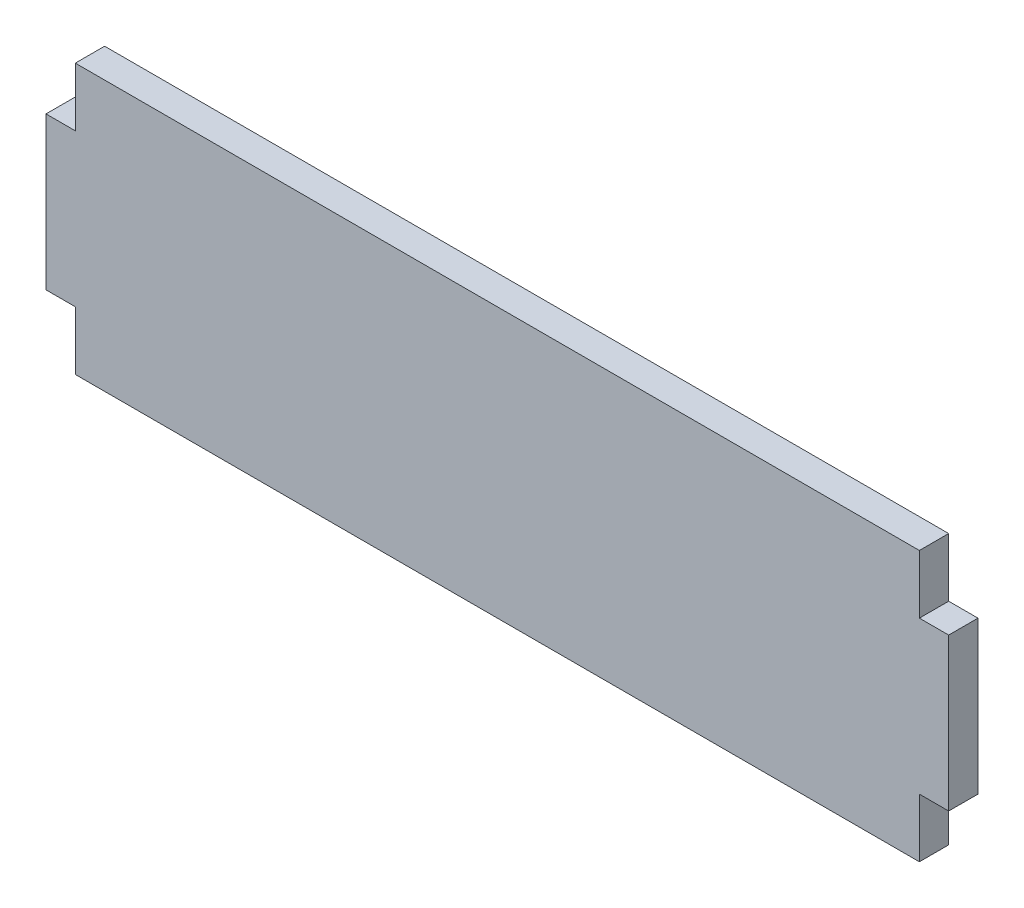
from build123d import *

# Parameters (mm, degrees)
BOSS_EXTRU_1_DEPTH = 5


with BuildPart() as part:
    # Esquisse1 → Boss.-Extru.1 (new body)
    with BuildSketch(Plane.XY):
        Polygon((-72, 23), (72, 23), (72, 13), (77, 13), (77, -13), (72, -13), (72, -23), (-72, -23), (-72, -13), (-77, -13), (-77, 13), (-72, 13), align=None)
    extrude(amount=BOSS_EXTRU_1_DEPTH)


solid = part.part
